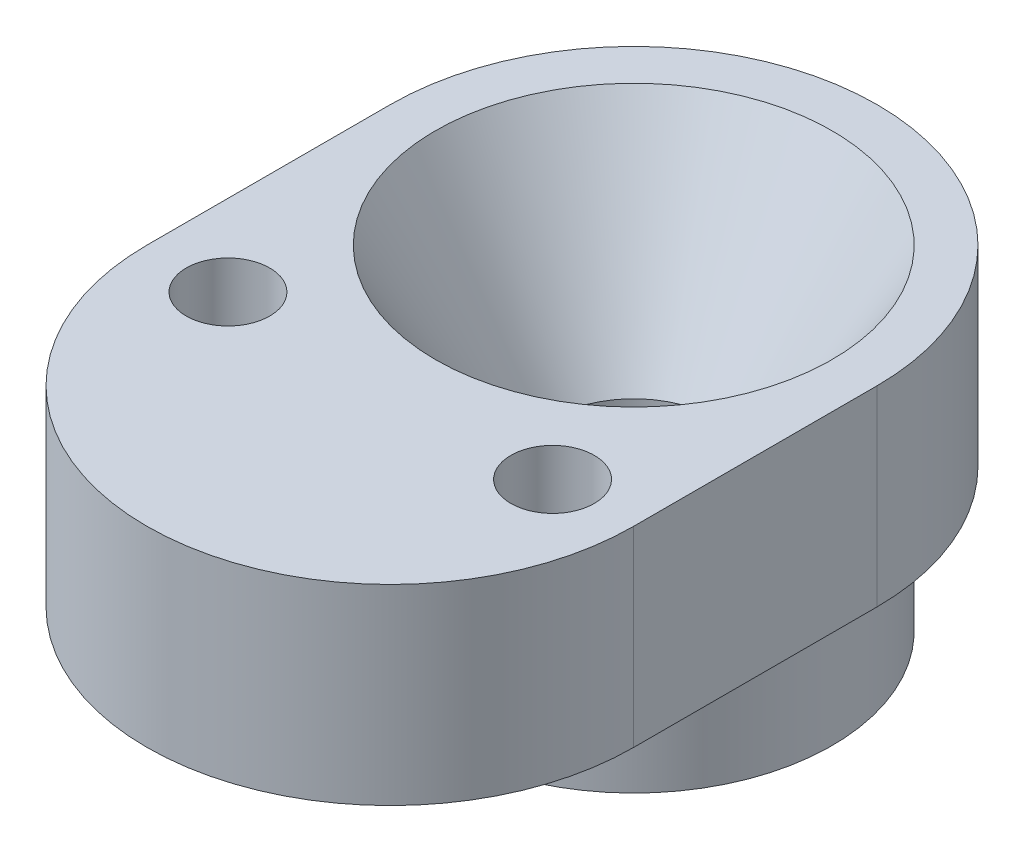
from build123d import *

# Parameters (mm, degrees)
SKETCH_315_R        = 3.237023897
SKETCH_315_R_2      = 1.631949552
SKETCH_315_R_3      = 1.631949719
EXTRUDE_1058_DEPTH  = 13.081
SKETCH_4_R          = 7.758938489
SKETCH_4_R_2        = 1.631949552
SKETCH_4_R_3        = 1.631949719
SKETCH_4_R_4        = 3.237023897
CUT_EXTRUDE_3_DEPTH = 5.588
SKETCH_4_2_R        = 7.758938489
SKETCH_5_R          = 3.237023897


with BuildPart() as part:
    # Sketch 315 → Extrude 1058 (new body)
    with BuildSketch(Plane(origin=(0, 0, 0), x_dir=(1, 0, 0), z_dir=(0, 1, 0))):
        with BuildLine():
            Line((0, -9.525000572), (0, -19.050001144))
            ThreePointArc((0, -19.050001144), (9.525002003, -28.575000286), (19.050001144, -19.049998283))
            Line((19.050001144, -19.049998283), (19.050001144, -9.525000572))
            ThreePointArc((19.050001144, -9.525000572), (9.525000572, 0), (0, -9.525000572))
        make_face()
        with Locations(Location((9.525000572, -9.525000572, 0), (0, 0, 270))):
            Circle(SKETCH_315_R, mode=Mode.SUBTRACT)
        with Locations(Location((3.175000612, -19.049999854, 0), (0, 0, 270))):
            Circle(SKETCH_315_R_2, mode=Mode.SUBTRACT)
        with Locations(Location((15.874999739, -19.050000406, 0), (0, 0, 270))):
            Circle(SKETCH_315_R_3, mode=Mode.SUBTRACT)
    extrude(amount=EXTRUDE_1058_DEPTH)

    # Sketch 4 → 拉伸3 (cut)
    # profile 1 of 2: a face of its own
    with BuildSketch(Plane(origin=(0, 0, 0), x_dir=(1, 0, 0), z_dir=(0, 1, 0))):
        with BuildLine():
            Line((0, -9.525000572), (0, -19.050001144))
            ThreePointArc((0, -19.050001144), (9.525002003, -28.575000286), (19.050001144, -19.049998283))
            Line((19.050001144, -19.049998283), (19.050001144, -9.525000572))
            ThreePointArc((19.050001144, -9.525000572), (9.525000572, 0), (0, -9.525000572))
        make_face()
        with Locations(Location((9.525000572, -9.525000572, 0), (0, 0, 270))):
            Circle(SKETCH_4_R, mode=Mode.SUBTRACT)
        with Locations(Location((3.175000612, -19.049999854, 0), (0, 0, 270))):
            Circle(SKETCH_4_R_2, mode=Mode.SUBTRACT)
        with Locations(Location((15.874999739, -19.050000406, 0), (0, 0, 270))):
            Circle(SKETCH_4_R_3, mode=Mode.SUBTRACT)
    # profile 2 of 2: a face of its own
    with BuildSketch(Plane(origin=(0, 0, 0), x_dir=(1, 0, 0), z_dir=(0, 1, 0))):
        with Locations(Location((9.525000572, -9.525000572, 0), (0, 0, 270))):
            Circle(SKETCH_4_R_4)
    extrude(amount=CUT_EXTRUDE_3_DEPTH, mode=Mode.SUBTRACT)

    # Sketch 4 2 → 切除-放样1 section 0
    with BuildSketch(Plane(origin=(0, 13.081000328, 0), x_dir=(1, 0, 0), z_dir=(0, 1, 0))):
        with Locations((9.525000572, -9.525000572)):
            Circle(SKETCH_4_2_R)
    # 草图5 → 切除-放样1 section 1
    with BuildSketch(Plane.XZ.offset(-5.588000298)):
        with Locations((9.525000572, 9.525000572)):
            Circle(SKETCH_5_R)
    loft(mode=Mode.SUBTRACT)


solid = part.part
